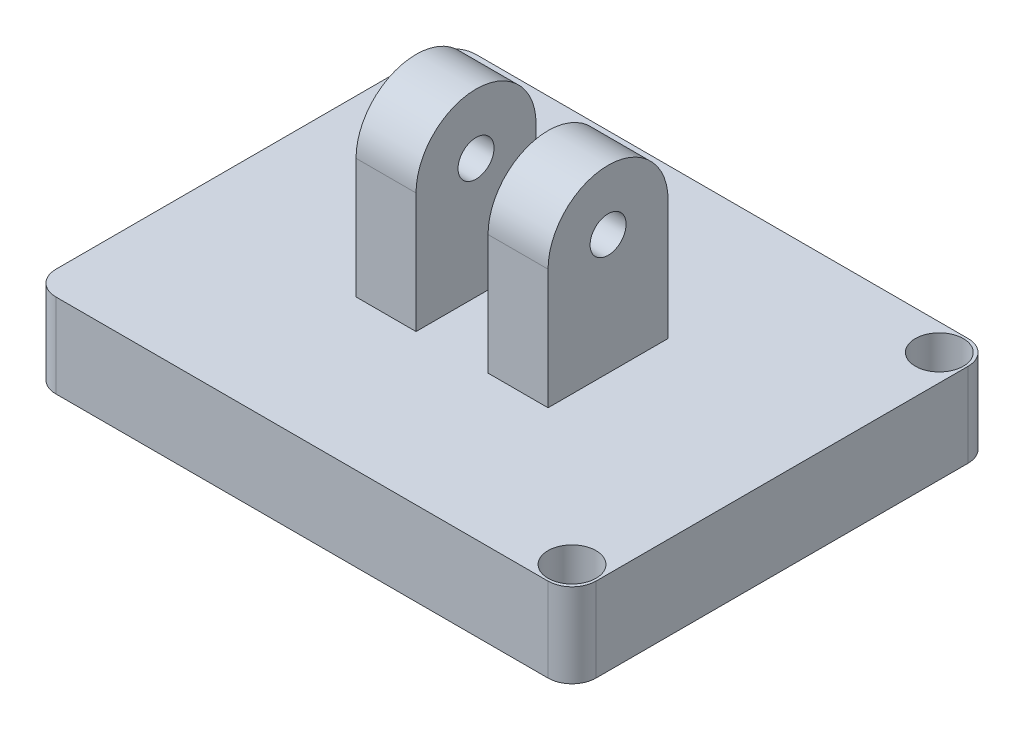
from build123d import *

# Parameters (mm, degrees)
SKETCH_1_W          = 45
SKETCH_1_H          = 35
EXTRUDE_1_DEPTH     = 7
SKETCH_2_R          = 2
CUT_EXTRUDE_1_DEPTH = 7
FILLET_1_R          = 2
SKETCH_3_R          = 1.5
EXTRUDE_2_DEPTH     = 8
SKETCH_3_2_R        = 1.5
CUT_EXTRUDE_2_DEPTH = 3


with BuildPart() as part:
    # 草图1 → 凸台-拉伸1 (new body)
    with BuildSketch(Plane(origin=(0, 0, 0), x_dir=(1, 0, 0), z_dir=(0, 1, 0))):
        Rectangle(SKETCH_1_W, SKETCH_1_H)
    extrude(amount=EXTRUDE_1_DEPTH)

    # 草图2 → 切除-拉伸1 (cut)
    with BuildSketch(Plane(origin=(0, 7, 0), x_dir=(1, 0, 0), z_dir=(0, 1, 0))):
        with Locations((20.3, 15.3)):
            Circle(SKETCH_2_R)
        with Locations((20.3, -15.3)):
            Circle(SKETCH_2_R)
    extrude(amount=-CUT_EXTRUDE_1_DEPTH, mode=Mode.SUBTRACT)

    # 圆角1
    fillet_1_edges = [part.edges().sort_by_distance(p)[0] for p in [
        (-22.5, 3.5, -17.5),
        (22.5, 3.5, -17.5),
        (-22.5, 3.5, 17.5),
        (22.5, 3.5, 17.5),
    ]]
    fillet(fillet_1_edges, radius=FILLET_1_R)

    # 草图3 → 凸台-拉伸2 (add, symmetric)
    with BuildSketch(Plane(origin=(0, 0, 0), x_dir=(0, 0, -1), z_dir=(1, 0, 0))):
        with BuildLine():
            Line((0.005, 7), (-4.995, 7))
            Line((-4.995, 7), (-4.995, 17))
            ThreePointArc((-4.995, 17), (0.005, 22), (5.005, 17))
            Line((5.005, 17), (5.005, 7))
            Line((5.005, 7), (0.005, 7))
        make_face()
        with Locations((0.005, 17)):
            Circle(SKETCH_3_R, mode=Mode.SUBTRACT)
    extrude(amount=EXTRUDE_2_DEPTH, both=True)

    # 草图3<2> → 切除-拉伸2 (cut, symmetric)
    with BuildSketch(Plane(origin=(0, 0, 0), x_dir=(0, 0, -1), z_dir=(1, 0, 0))):
        with BuildLine():
            Line((0.005, 7), (-4.995, 7))
            Line((-4.995, 7), (-4.995, 17))
            ThreePointArc((-4.995, 17), (0.005, 22), (5.005, 17))
            Line((5.005, 17), (5.005, 7))
            Line((5.005, 7), (0.005, 7))
        make_face()
        with Locations((0.005, 17)):
            Circle(SKETCH_3_2_R, mode=Mode.SUBTRACT)
    extrude(amount=CUT_EXTRUDE_2_DEPTH, both=True, mode=Mode.SUBTRACT)


solid = part.part
